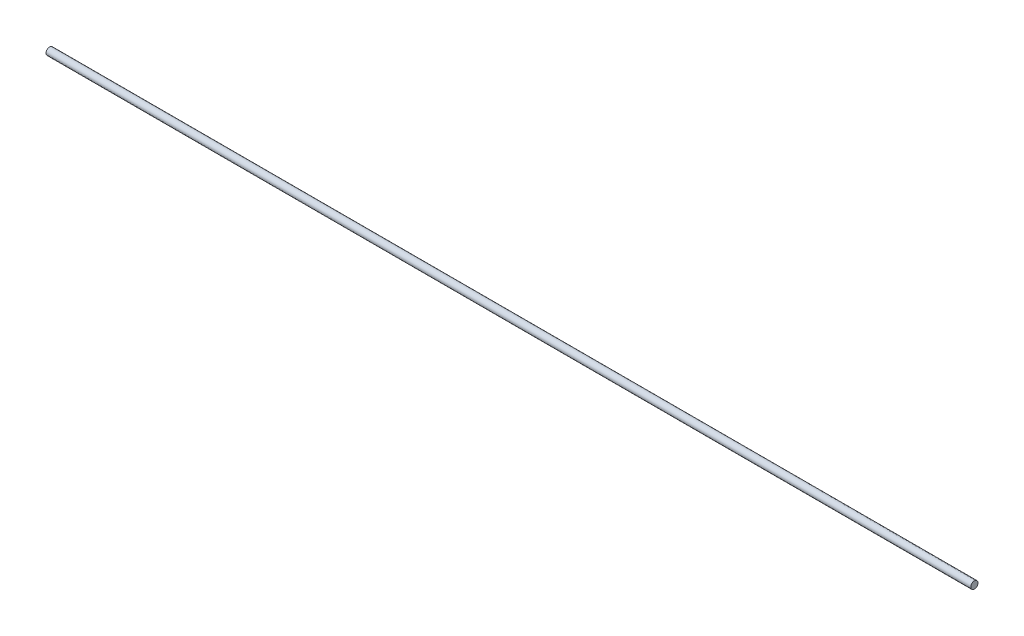
from build123d import *

# Parameters (mm, degrees)
SKETCH1_R           = 3.175
BOSS_EXTRUDE1_DEPTH = 812.8


with BuildPart() as part:
    # Sketch1 → Boss-Extrude1 (new body)
    with BuildSketch(Plane(origin=(0, 0, 0), x_dir=(0, 0, -1), z_dir=(1, 0, 0))):
        with Locations((4.795611117, 16.226241471)):
            Circle(SKETCH1_R)
    extrude(amount=BOSS_EXTRUDE1_DEPTH)


solid = part.part
